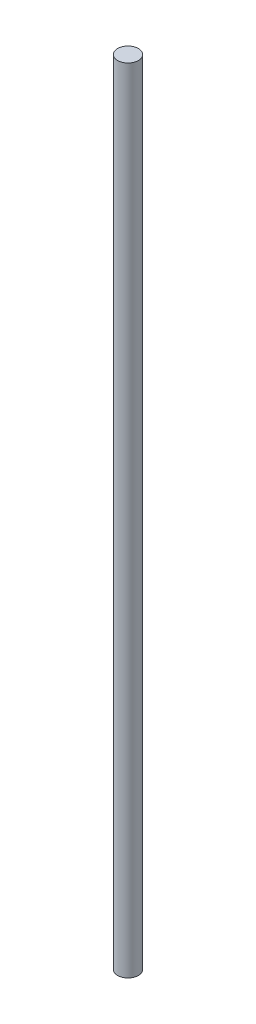
from build123d import *

# Parameters (mm, degrees)
SKETCH1_R           = 5
BOSS_EXTRUDE1_DEPTH = 380


with BuildPart() as part:
    # Sketch1 → Boss-Extrude1 (new body)
    with BuildSketch(Plane(origin=(0, 0, 0), x_dir=(1, 0, 0), z_dir=(0, 1, 0))):
        with Locations(Location((0, 0, 0), (0, 0, 270))):
            Circle(SKETCH1_R)
    extrude(amount=BOSS_EXTRUDE1_DEPTH)


solid = part.part
